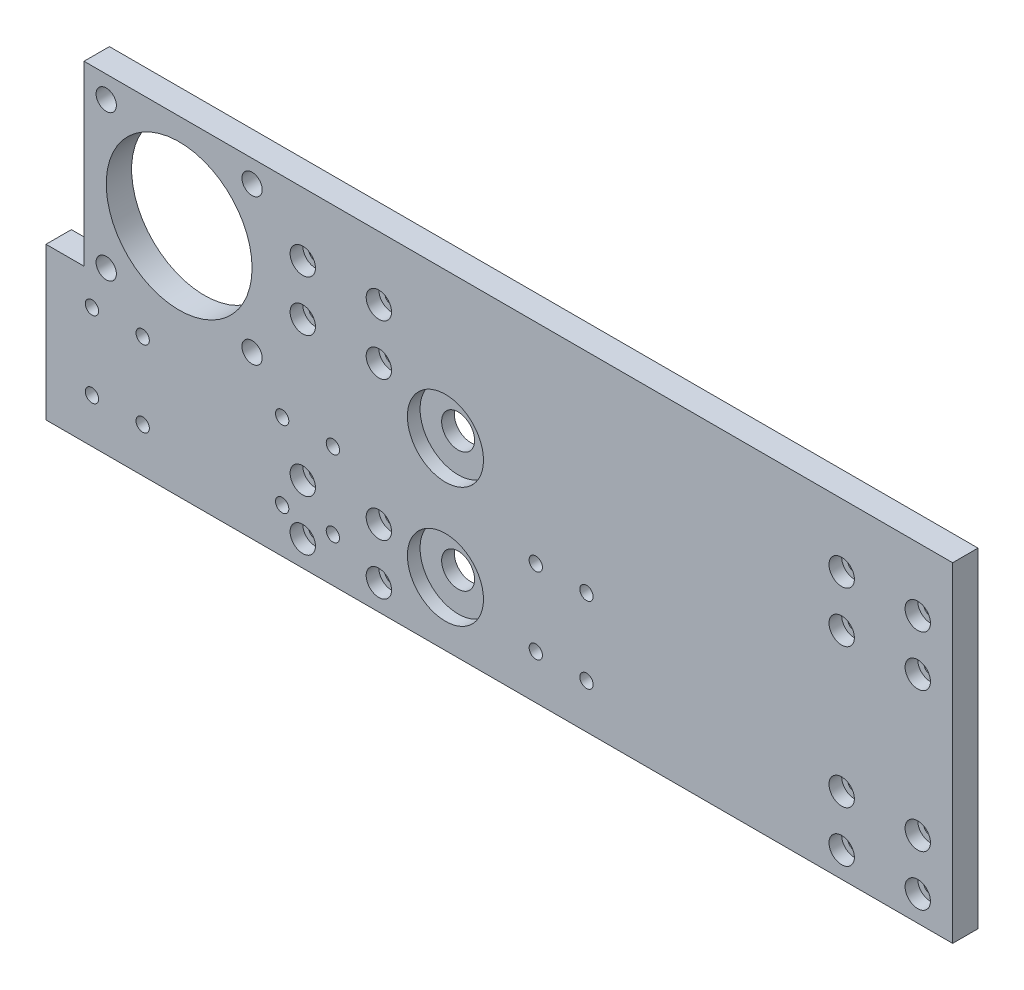
from build123d import *

# Parameters (mm, degrees)
SKETCH_1_R          = 11.5
SKETCH_1_R_2        = 1.6
SKETCH_1_R_3        = 1.05
SKETCH_1_R_4        = 2.6
EXTRUDE_1_DEPTH     = 4
SKETCH_2_R          = 2
SKETCH_2_R_2        = 6
CUT_EXTRUDE_1_DEPTH = 2
SKETCH_5_R          = 2
CUT_EXTRUDE_2_DEPTH = 2


with BuildPart() as part:
    # 草图1 → 凸台-拉伸1 (new body)
    with BuildSketch(Plane.XY):
        Polygon((0, 0), (135, 0), (135, -52), (0, -52), (-8, -52), (-8, -28), (-2, -28), (-2, 0), align=None)
        with Locations((13, -15)):
            Circle(SKETCH_1_R, mode=Mode.SUBTRACT)
        with Locations((1.5, -3.5)):
            Circle(SKETCH_1_R_2, mode=Mode.SUBTRACT)
        with Locations((24.5, -3.5)):
            Circle(SKETCH_1_R_2, mode=Mode.SUBTRACT)
        with Locations((1.5, -26.5)):
            Circle(SKETCH_1_R_2, mode=Mode.SUBTRACT)
        with Locations((24.5, -26.5)):
            Circle(SKETCH_1_R_2, mode=Mode.SUBTRACT)
        with Locations((32.5, -10)):
            Circle(SKETCH_1_R_3, mode=Mode.SUBTRACT)
        with Locations((44.5, -10)):
            Circle(SKETCH_1_R_3, mode=Mode.SUBTRACT)
        with Locations((32.5, -18)):
            Circle(SKETCH_1_R_3, mode=Mode.SUBTRACT)
        with Locations((44.5, -18)):
            Circle(SKETCH_1_R_3, mode=Mode.SUBTRACT)
        with Locations((117.5, -10)):
            Circle(SKETCH_1_R_3, mode=Mode.SUBTRACT)
        with Locations((129.5, -10)):
            Circle(SKETCH_1_R_3, mode=Mode.SUBTRACT)
        with Locations((117.5, -18)):
            Circle(SKETCH_1_R_3, mode=Mode.SUBTRACT)
        with Locations((129.5, -18)):
            Circle(SKETCH_1_R_3, mode=Mode.SUBTRACT)
        with Locations((-0.75, -33)):
            Circle(SKETCH_1_R_3, mode=Mode.SUBTRACT)
        with Locations((7.25, -33)):
            Circle(SKETCH_1_R_3, mode=Mode.SUBTRACT)
        with Locations((-0.75, -45)):
            Circle(SKETCH_1_R_3, mode=Mode.SUBTRACT)
        with Locations((7.25, -45)):
            Circle(SKETCH_1_R_3, mode=Mode.SUBTRACT)
        with Locations((29.25, -33)):
            Circle(SKETCH_1_R_3, mode=Mode.SUBTRACT)
        with Locations((37.25, -33)):
            Circle(SKETCH_1_R_3, mode=Mode.SUBTRACT)
        with Locations((37.25, -45)):
            Circle(SKETCH_1_R_3, mode=Mode.SUBTRACT)
        with Locations((29.25, -45)):
            Circle(SKETCH_1_R_3, mode=Mode.SUBTRACT)
        with Locations((32.5, -40)):
            Circle(SKETCH_1_R_3, mode=Mode.SUBTRACT)
        with Locations((44.5, -40)):
            Circle(SKETCH_1_R_3, mode=Mode.SUBTRACT)
        with Locations((32.5, -48)):
            Circle(SKETCH_1_R_3, mode=Mode.SUBTRACT)
        with Locations((44.5, -48)):
            Circle(SKETCH_1_R_3, mode=Mode.SUBTRACT)
        with Locations((117.5, -40)):
            Circle(SKETCH_1_R_3, mode=Mode.SUBTRACT)
        with Locations((129.5, -40)):
            Circle(SKETCH_1_R_3, mode=Mode.SUBTRACT)
        with Locations((117.5, -48)):
            Circle(SKETCH_1_R_3, mode=Mode.SUBTRACT)
        with Locations((129.5, -48)):
            Circle(SKETCH_1_R_3, mode=Mode.SUBTRACT)
        with Locations((55, -23)):
            Circle(SKETCH_1_R_4, mode=Mode.SUBTRACT)
        with Locations((55, -42)):
            Circle(SKETCH_1_R_4, mode=Mode.SUBTRACT)
        with Locations((77.25, -33)):
            Circle(SKETCH_1_R_3, mode=Mode.SUBTRACT)
        with Locations((77.25, -45)):
            Circle(SKETCH_1_R_3, mode=Mode.SUBTRACT)
        with Locations((69.25, -45)):
            Circle(SKETCH_1_R_3, mode=Mode.SUBTRACT)
        with Locations((69.25, -33)):
            Circle(SKETCH_1_R_3, mode=Mode.SUBTRACT)
    extrude(amount=EXTRUDE_1_DEPTH)

    # 草图2 → 切除-拉伸1 (cut)
    with BuildSketch(Plane.XY.offset(4)):
        with Locations((32.5, -10)):
            Circle(SKETCH_2_R)
        with Locations((44.5, -10)):
            Circle(SKETCH_2_R)
        with Locations((32.5, -18)):
            Circle(SKETCH_2_R)
        with Locations((44.5, -18)):
            Circle(SKETCH_2_R)
        with Locations((117.5, -10)):
            Circle(SKETCH_2_R)
        with Locations((129.5, -10)):
            Circle(SKETCH_2_R)
        with Locations((117.5, -18)):
            Circle(SKETCH_2_R)
        with Locations((129.5, -18)):
            Circle(SKETCH_2_R)
        with Locations((32.5, -40)):
            Circle(SKETCH_2_R)
        with Locations((44.5, -40)):
            Circle(SKETCH_2_R)
        with Locations((32.5, -48)):
            Circle(SKETCH_2_R)
        with Locations((44.5, -48)):
            Circle(SKETCH_2_R)
        with Locations((117.5, -40)):
            Circle(SKETCH_2_R)
        with Locations((129.5, -40)):
            Circle(SKETCH_2_R)
        with Locations((117.5, -48)):
            Circle(SKETCH_2_R)
        with Locations((55, -23)):
            Circle(SKETCH_2_R_2)
        with Locations((129.5, -48)):
            Circle(SKETCH_2_R)
        with Locations((55, -42)):
            Circle(SKETCH_2_R_2)
    extrude(amount=-CUT_EXTRUDE_1_DEPTH, mode=Mode.SUBTRACT)

    # 草图5 → 切除-拉伸2 (cut)
    with BuildSketch(Plane(origin=(0, 0, 0), x_dir=(-1, 0, 0), z_dir=(0, 0, -1))):
        with Locations((-37.25, -33)):
            Circle(SKETCH_5_R)
        with Locations((-29.25, -33)):
            Circle(SKETCH_5_R)
        with Locations((-37.25, -45)):
            Circle(SKETCH_5_R)
        with Locations((-29.25, -45)):
            Circle(SKETCH_5_R)
        with Locations((-7.25, -33)):
            Circle(SKETCH_5_R)
        with Locations((0.75, -33)):
            Circle(SKETCH_5_R)
        with Locations((-7.25, -45)):
            Circle(SKETCH_5_R)
        with Locations((0.75, -45)):
            Circle(SKETCH_5_R)
        with Locations((-69.25, -33)):
            Circle(SKETCH_5_R)
        with Locations((-69.25, -45)):
            Circle(SKETCH_5_R)
        with Locations((-77.25, -45)):
            Circle(SKETCH_5_R)
        with Locations((-77.25, -33)):
            Circle(SKETCH_5_R)
    extrude(amount=-CUT_EXTRUDE_2_DEPTH, mode=Mode.SUBTRACT)


solid = part.part
